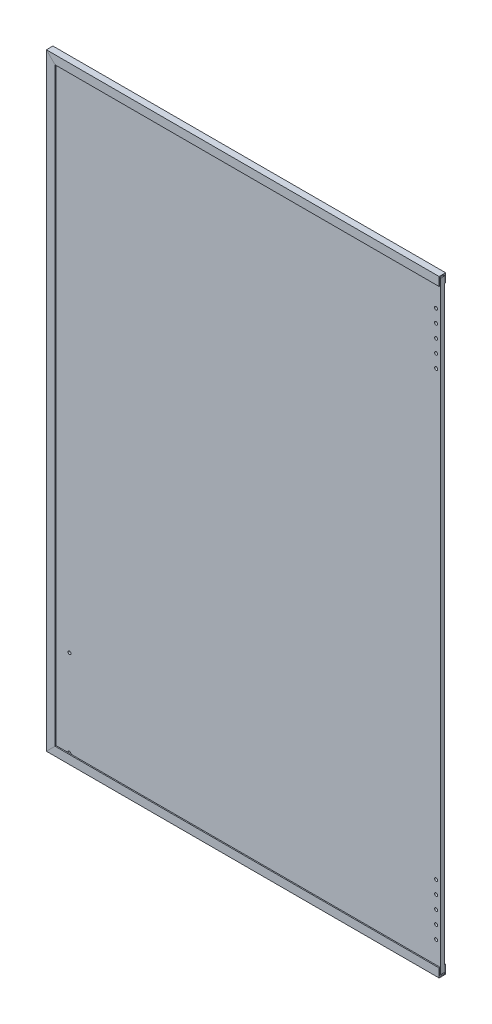
from build123d import *

# Parameters (mm, degrees)
SKETCH2_W                             = 574.675
SKETCH2_H                             = 889
FRAME_OUTER_DIMENSIONS_DEPTH          = 4.7625
SKETCH3_W                             = 561.975
SKETCH3_H                             = 863.6
FRAME_INNER_DIMENSIONS_DEPTH          = 1050.71569395
FRAME_PROFILE_DEPTH                   = 3.175
FRAME_PROFILE_DEPTH_BACK              = 3.175
SKETCH4_W                             = 573.0875
SKETCH4_H                             = 885.825
FRAME_SECTION_SPLIT_SURFACE_1_1_BACK  = 1059.614
FRAME_SECTION_SPLIT_SURFACE_1_1_DEPTH = 2119.228
FRAME_SECTION_SPLIT_SURFACE_1_2_BACK  = 1059.614
FRAME_SECTION_SPLIT_SURFACE_1_2_DEPTH = 2119.228
FRAME_SECTION_SPLIT_SURFACE_2_3_BACK  = 1059.614
FRAME_SECTION_SPLIT_SURFACE_2_3_DEPTH = 2119.228
FRAME_SECTION_SPLIT_SURFACE_2_4_BACK  = 1059.614
FRAME_SECTION_SPLIT_SURFACE_2_4_DEPTH = 2119.228
SKETCH5_W                             = 571.5
SKETCH5_H                             = 882.65
DOOR_PANEL_DEPTH                      = 2.794
SKETCH9_W                             = 2.2479
SKETCH9_H                             = 7.5565
F_8_CLEARANCE_HOLE1_AT_2_COUNT        = 2
F_8_CLEARANCE_HOLE1_AT_2_PITCH        = 19.05
F_8_CLEARANCE_HOLE1_AT_3_COUNT        = 2
F_8_CLEARANCE_HOLE1_AT_3_PITCH        = 38.1
F_8_CLEARANCE_HOLE1_AT_4_COUNT        = 2
F_8_CLEARANCE_HOLE1_AT_4_PITCH        = 57.15
F_8_CLEARANCE_HOLE1_AT_5_COUNT        = 2
F_8_CLEARANCE_HOLE1_AT_5_PITCH        = 76.2
F_8_CLEARANCE_HOLE1_AT_6_COUNT        = 2
F_8_CLEARANCE_HOLE1_AT_6_PITCH        = 742.95
F_8_CLEARANCE_HOLE1_AT_7_COUNT        = 2
F_8_CLEARANCE_HOLE1_AT_7_PITCH        = 762
F_8_CLEARANCE_HOLE1_AT_8_COUNT        = 2
F_8_CLEARANCE_HOLE1_AT_8_PITCH        = 781.05
F_8_CLEARANCE_HOLE1_AT_9_COUNT        = 2
F_8_CLEARANCE_HOLE1_AT_9_PITCH        = 800.1
F_8_CLEARANCE_HOLE1_AT_10_COUNT       = 2
F_8_CLEARANCE_HOLE1_AT_10_PITCH       = 723.9
SKETCH12_W                            = 2.2479
SKETCH12_H                            = 7.5565
F_8_CLEARANCE_HOLE2_AT_2_COUNT        = 2
F_8_CLEARANCE_HOLE2_AT_2_PITCH        = 127


with BuildPart() as part:
    # Sketch2 → Frame outer dimensions (new, symmetric)
    with BuildSketch(Plane.XY):
        with Locations((290.5125, 431.8)):
            Rectangle(SKETCH2_W, SKETCH2_H)
    extrude(amount=FRAME_OUTER_DIMENSIONS_DEPTH, both=True)

    # Sketch3 → Frame inner dimensions (cut, through all)
    with BuildSketch(Plane.XY.offset(4.7625)):
        with Locations((296.8625, 431.8)):
            Rectangle(SKETCH3_W, SKETCH3_H)
    extrude(amount=-FRAME_INNER_DIMENSIONS_DEPTH, mode=Mode.SUBTRACT)

    # Sketch4 → Frame profile (cut, two sides: drawn at the far end of the back side and taken through both)
    with BuildSketch(Plane.XY.offset(-FRAME_PROFILE_DEPTH_BACK)):
        with Locations((291.30625, 431.8)):
            Rectangle(SKETCH4_W, SKETCH4_H)
    extrude(amount=FRAME_PROFILE_DEPTH + FRAME_PROFILE_DEPTH_BACK, mode=Mode.SUBTRACT)


with BuildPart() as body_2:
    # Frame section split: the piece behind the surface
    add(part.part)
    # Frame section split surface 1: a surface, the sketch's curves swept straight by 2119.228 mm
    with BuildLine(Plane.XY.offset(4.7625).offset(-FRAME_SECTION_SPLIT_SURFACE_1_1_BACK), mode=Mode.PRIVATE) as frame_section_split_surface_1_1_path:
        Line((3.175, 876.3), (15.875, 863.6))
    frame_section_split_surface_1_1 = Shell.extrude(frame_section_split_surface_1_1_path.wire(), (0 * FRAME_SECTION_SPLIT_SURFACE_1_1_DEPTH, 0 * FRAME_SECTION_SPLIT_SURFACE_1_1_DEPTH, 1 * FRAME_SECTION_SPLIT_SURFACE_1_1_DEPTH))
    split(bisect_by=frame_section_split_surface_1_1, keep=Keep.BOTTOM)


with BuildPart() as part_1:
    add(part.part)

    # Frame section split: split by a surface, the side it looks to stays
    # Frame section split surface 1: a surface, the sketch's curves swept straight by 2119.228 mm
    with BuildLine(Plane.XY.offset(4.7625).offset(-FRAME_SECTION_SPLIT_SURFACE_1_2_BACK), mode=Mode.PRIVATE) as frame_section_split_surface_1_2_path:
        Line((3.175, 876.3), (15.875, 863.6))
    frame_section_split_surface_1_2 = Shell.extrude(frame_section_split_surface_1_2_path.wire(), (0 * FRAME_SECTION_SPLIT_SURFACE_1_2_DEPTH, 0 * FRAME_SECTION_SPLIT_SURFACE_1_2_DEPTH, 1 * FRAME_SECTION_SPLIT_SURFACE_1_2_DEPTH))
    split(bisect_by=frame_section_split_surface_1_2, keep=Keep.TOP)


with BuildPart() as body_3:
    # Frame section split 2 body 2: the piece behind the surface
    add(body_2.part)
    # Frame section split surface 2: a surface, the sketch's curves swept straight by 2119.228 mm
    with BuildLine(Plane.XY.offset(4.7625).offset(-FRAME_SECTION_SPLIT_SURFACE_2_3_BACK), mode=Mode.PRIVATE) as frame_section_split_surface_2_3_path:
        Line((3.175, -12.7), (15.875, 0))
    frame_section_split_surface_2_3 = Shell.extrude(frame_section_split_surface_2_3_path.wire(), (0 * FRAME_SECTION_SPLIT_SURFACE_2_3_DEPTH, 0 * FRAME_SECTION_SPLIT_SURFACE_2_3_DEPTH, 1 * FRAME_SECTION_SPLIT_SURFACE_2_3_DEPTH))
    split(bisect_by=frame_section_split_surface_2_3, keep=Keep.BOTTOM)


with BuildPart() as body_2_1:
    add(body_2.part)

    # Frame section split 2 body 2: split by a surface, the side it looks to stays
    # Frame section split surface 2: a surface, the sketch's curves swept straight by 2119.228 mm
    with BuildLine(Plane.XY.offset(4.7625).offset(-FRAME_SECTION_SPLIT_SURFACE_2_4_BACK), mode=Mode.PRIVATE) as frame_section_split_surface_2_4_path:
        Line((3.175, -12.7), (15.875, 0))
    frame_section_split_surface_2_4 = Shell.extrude(frame_section_split_surface_2_4_path.wire(), (0 * FRAME_SECTION_SPLIT_SURFACE_2_4_DEPTH, 0 * FRAME_SECTION_SPLIT_SURFACE_2_4_DEPTH, 1 * FRAME_SECTION_SPLIT_SURFACE_2_4_DEPTH))
    split(bisect_by=frame_section_split_surface_2_4, keep=Keep.TOP)


with BuildPart() as body_4:
    # Sketch5 → Door panel (new, symmetric)
    with BuildSketch(Plane.XY):
        with Locations((292.1, 431.8)):
            Rectangle(SKETCH5_W, SKETCH5_H)
    extrude(amount=DOOR_PANEL_DEPTH, both=True)

    # Sketch9 → #8 Clearance Hole1 (revolve, cut)
    with BuildSketch(Plane(origin=(571.5, 31.75, 2.794), x_dir=(0, -1, 0), z_dir=(1, 0, 0))):
        with Locations((1.12395, 3.77825)):
            Rectangle(SKETCH9_W, SKETCH9_H)
    f_8_clearance_hole1 = revolve(axis=Axis((571.5, 31.75, 9.144), (0, 0, -1)), mode=Mode.SUBTRACT)

    # #8 Clearance Hole1 at 2: #8 Clearance Hole1 ×2
    with Locations(*[(0, i * F_8_CLEARANCE_HOLE1_AT_2_PITCH, 0) for i in range(1, F_8_CLEARANCE_HOLE1_AT_2_COUNT)]):
        add(f_8_clearance_hole1, mode=Mode.SUBTRACT)

    # #8 Clearance Hole1 at 3: #8 Clearance Hole1 ×2
    with Locations(*[(0, i * F_8_CLEARANCE_HOLE1_AT_3_PITCH, 0) for i in range(1, F_8_CLEARANCE_HOLE1_AT_3_COUNT)]):
        add(f_8_clearance_hole1, mode=Mode.SUBTRACT)

    # #8 Clearance Hole1 at 4: #8 Clearance Hole1 ×2
    with Locations(*[(0, i * F_8_CLEARANCE_HOLE1_AT_4_PITCH, 0) for i in range(1, F_8_CLEARANCE_HOLE1_AT_4_COUNT)]):
        add(f_8_clearance_hole1, mode=Mode.SUBTRACT)

    # #8 Clearance Hole1 at 5: #8 Clearance Hole1 ×2
    with Locations(*[(0, i * F_8_CLEARANCE_HOLE1_AT_5_PITCH, 0) for i in range(1, F_8_CLEARANCE_HOLE1_AT_5_COUNT)]):
        add(f_8_clearance_hole1, mode=Mode.SUBTRACT)

    # #8 Clearance Hole1 at 6: #8 Clearance Hole1 ×2
    with Locations(*[(0, i * F_8_CLEARANCE_HOLE1_AT_6_PITCH, 0) for i in range(1, F_8_CLEARANCE_HOLE1_AT_6_COUNT)]):
        add(f_8_clearance_hole1, mode=Mode.SUBTRACT)

    # #8 Clearance Hole1 at 7: #8 Clearance Hole1 ×2
    with Locations(*[(0, i * F_8_CLEARANCE_HOLE1_AT_7_PITCH, 0) for i in range(1, F_8_CLEARANCE_HOLE1_AT_7_COUNT)]):
        add(f_8_clearance_hole1, mode=Mode.SUBTRACT)

    # #8 Clearance Hole1 at 8: #8 Clearance Hole1 ×2
    with Locations(*[(0, i * F_8_CLEARANCE_HOLE1_AT_8_PITCH, 0) for i in range(1, F_8_CLEARANCE_HOLE1_AT_8_COUNT)]):
        add(f_8_clearance_hole1, mode=Mode.SUBTRACT)

    # #8 Clearance Hole1 at 9: #8 Clearance Hole1 ×2
    with Locations(*[(0, i * F_8_CLEARANCE_HOLE1_AT_9_PITCH, 0) for i in range(1, F_8_CLEARANCE_HOLE1_AT_9_COUNT)]):
        add(f_8_clearance_hole1, mode=Mode.SUBTRACT)

    # #8 Clearance Hole1 at 10: #8 Clearance Hole1 ×2
    with Locations(*[(0, i * F_8_CLEARANCE_HOLE1_AT_10_PITCH, 0) for i in range(1, F_8_CLEARANCE_HOLE1_AT_10_COUNT)]):
        add(f_8_clearance_hole1, mode=Mode.SUBTRACT)

    # Sketch12 → #8 Clearance Hole2 (revolve, cut)
    with BuildSketch(Plane(origin=(34.925, 0, 2.794), x_dir=(0, -1, 0), z_dir=(1, 0, 0))):
        with Locations((1.12395, 3.77825)):
            Rectangle(SKETCH12_W, SKETCH12_H)
    f_8_clearance_hole2 = revolve(axis=Axis((34.925, 0, 9.144), (0, 0, -1)), mode=Mode.SUBTRACT)

    # #8 Clearance Hole2 at 2: #8 Clearance Hole2 ×2
    with Locations(*[(0, i * F_8_CLEARANCE_HOLE2_AT_2_PITCH, 0) for i in range(1, F_8_CLEARANCE_HOLE2_AT_2_COUNT)]):
        add(f_8_clearance_hole2, mode=Mode.SUBTRACT)


with BuildPart() as body_5:
    # Mirror1: mirrored copy
    add(part_1.part.mirror(Plane(origin=(0, 0, 0), x_dir=(0, 0, 1), z_dir=(1, 0, 0))))


with BuildPart() as body_6:
    # Mirror1 2: mirrored copy
    add(body_2_1.part.mirror(Plane(origin=(0, 0, 0), x_dir=(0, 0, 1), z_dir=(1, 0, 0))))


with BuildPart() as body_7:
    # Mirror1 3: mirrored copy
    add(body_3.part.mirror(Plane(origin=(0, 0, 0), x_dir=(0, 0, 1), z_dir=(1, 0, 0))))


with BuildPart() as body_8:
    # Mirror1 4: mirrored copy
    add(body_4.part.mirror(Plane(origin=(0, 0, 0), x_dir=(0, 0, 1), z_dir=(1, 0, 0))))


solid = Compound([part_1.part, body_3.part, body_2_1.part, body_4.part])
